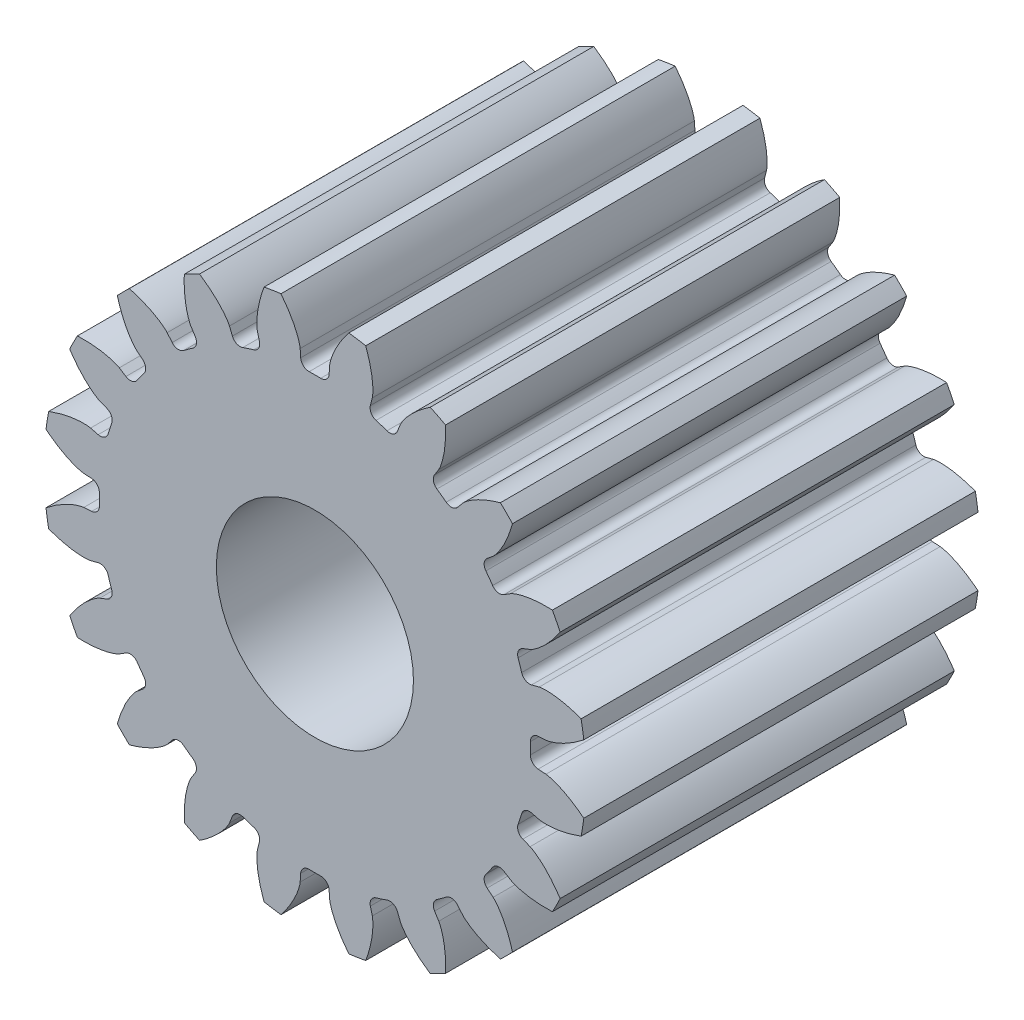
from build123d import *

# Parameters (mm, degrees)
BOSS_EXTRUDE1_DEPTH        = 6.35
BOSS_EXTRUDE1_DEPTH_BACK   = 6.35
SKETCH3_R                  = 8.73125
CUT_EXTRUDE1_DEPTH         = 14.8849542
FILLET1_R                  = 0.266307122
CIRPATTERN1_COUNT          = 20
FILLET1_OF_CIRPATTERN1_R   = 0.266307122
F_1_4_0_2500_DOWEL_HOLE1_D = 6.35


with BuildPart() as part:
    # Sketch3 → Boss-Extrude1 (new, two sides: drawn at the far end of the back side and taken through both)
    with BuildSketch(Plane.XY.offset(-BOSS_EXTRUDE1_DEPTH_BACK)):
        Circle(SKETCH3_R)
    extrude(amount=BOSS_EXTRUDE1_DEPTH + BOSS_EXTRUDE1_DEPTH_BACK)

    # Sketch4 → Cut-Extrude1 (cut, symmetric)
    with BuildSketch(Plane.XY):
        with BuildLine():
            Line((6.931254834, 0.441669736), (7.443713166, 0.474324333))
            add(Edge.make_bspline(
                [(7.443713166, 0.474324333), (7.445749281, 0.474480419), (7.451453983, 0.474999392), (7.462213638, 0.476301083), (7.479726875, 0.478879707), (7.501970922, 0.482832773), (7.530628947, 0.488707219), (7.564257997, 0.496609686), (7.601064508, 0.5063211), (7.640930813, 0.517992074), (7.680534659, 0.530610788), (7.719873659, 0.544103848), (7.758903021, 0.558360044), (7.805981096, 0.576588942), (7.862148006, 0.599780003), (7.927353742, 0.628819757), (8.000758569, 0.664029811), (8.074942785, 0.702332545), (8.147410395, 0.742004754), (8.219980447, 0.784351492), (8.28973336, 0.826927026), (8.361473654, 0.873447803), (8.427334734, 0.917559362), (8.500291543, 0.969502228), (8.558929121, 1.012158882), (8.61877941, 1.058311217), (8.647801029, 1.081081206), (8.662586878, 1.092847266)],
                knots=[0, 0, 0, 0, 0, 0.005376749, 0.015083688, 0.02853182, 0.04661014, 0.064854849, 0.092110526, 0.119476176, 0.146842496, 0.174208854, 0.201574956, 0.228941013, 0.256307345, 0.307035032, 0.361767352, 0.416499661, 0.471231937, 0.525964282, 0.580696616, 0.635428982, 0.690161387, 0.744893688, 0.799626082, 0.854358407, 0.909090915, 0.909090915, 0.909090915, 0.909090915, 0.909090915], degree=4))
            ThreePointArc((8.662586878, 1.092847266), (8.73125, 0), (8.662586878, -1.092847266))
            add(Edge.make_bspline(
                [(7.443713166, -0.474324333), (7.445749281, -0.474480419), (7.451453983, -0.474999392), (7.462213638, -0.476301083), (7.479726875, -0.478879707), (7.501970922, -0.482832773), (7.530628947, -0.488707219), (7.564257997, -0.496609686), (7.601064508, -0.5063211), (7.640930813, -0.517992074), (7.680534659, -0.530610788), (7.719873659, -0.544103848), (7.758903021, -0.558360044), (7.805981096, -0.576588942), (7.862148006, -0.599780003), (7.927353742, -0.628819757), (8.000758569, -0.664029811), (8.074942785, -0.702332545), (8.147410395, -0.742004754), (8.219980447, -0.784351492), (8.28973336, -0.826927026), (8.361473654, -0.873447803), (8.427334734, -0.917559362), (8.500291543, -0.969502228), (8.558929121, -1.012158882), (8.61877941, -1.058311217), (8.647801029, -1.081081206), (8.662586878, -1.092847266)],
                knots=[0, 0, 0, 0, 0, 0.005376749, 0.015083688, 0.02853182, 0.04661014, 0.064854849, 0.092110526, 0.119476176, 0.146842496, 0.174208854, 0.201574956, 0.228941013, 0.256307345, 0.307035032, 0.361767352, 0.416499661, 0.471231937, 0.525964282, 0.580696616, 0.635428982, 0.690161387, 0.744893688, 0.799626082, 0.854358407, 0.909090915, 0.909090915, 0.909090915, 0.909090915, 0.909090915], degree=4))
            Line((7.443713166, -0.474324333), (6.931254834, -0.441669736))
            ThreePointArc((6.931254834, -0.441669736), (6.9453125, 0), (6.931254834, 0.441669736))
        make_face()
    cut_extrude1 = extrude(amount=CUT_EXTRUDE1_DEPTH, both=True, mode=Mode.SUBTRACT)

    # Fillet1
    fillet1_edges = [part.edges().sort_by_distance(p)[0] for p in [
        (6.931254834, -0.441669736, 0),
        (6.931254834, 0.441669736, 0),
    ]]
    fillet(fillet1_edges, radius=FILLET1_R)

    # CirPattern1: Cut-Extrude1 ×20 about axis
    cirpattern1_axis = Axis((0, 0, 6.35), (0, 0, -1))
    for i in range(1, CIRPATTERN1_COUNT):
        add(cut_extrude1.rotate(cirpattern1_axis, i * 360 / CIRPATTERN1_COUNT), mode=Mode.SUBTRACT)

    # Fillet1 of CirPattern1
    fillet1_of_cirpattern1_edges = [part.edges().sort_by_distance(p)[0] for p in [
        (6.455531621, -2.561928416, 0),
        (6.72849853, -1.721822656, 0),
        (5.347895996, -4.431407693, 0),
        (5.86710991, -3.716771049, 0),
        (3.716771049, -5.86710991, 0),
        (4.431407693, -5.347895996, 0),
        (1.721822656, -6.72849853, 0),
        (2.561928416, -6.455531621, 0),
        (-0.441669736, -6.931254834, 0),
        (0.441669736, -6.931254834, 0),
        (-2.561928416, -6.455531621, 0),
        (-1.721822656, -6.72849853, 0),
        (-4.431407693, -5.347895996, 0),
        (-3.716771049, -5.86710991, 0),
        (-5.86710991, -3.716771049, 0),
        (-5.347895996, -4.431407693, 0),
        (-6.72849853, -1.721822656, 0),
        (-6.455531621, -2.561928416, 0),
        (-6.931254834, 0.441669736, 0),
        (-6.931254834, -0.441669736, 0),
        (-6.455531621, 2.561928416, 0),
        (-6.72849853, 1.721822656, 0),
        (-5.347895996, 4.431407693, 0),
        (-5.86710991, 3.716771049, 0),
        (-3.716771049, 5.86710991, 0),
        (-4.431407693, 5.347895996, 0),
        (-1.721822656, 6.72849853, 0),
        (-2.561928416, 6.455531621, 0),
        (0.441669736, 6.931254834, 0),
        (-0.441669736, 6.931254834, 0),
        (2.561928416, 6.455531621, 0),
        (1.721822656, 6.72849853, 0),
        (4.431407693, 5.347895996, 0),
        (3.716771049, 5.86710991, 0),
        (5.86710991, 3.716771049, 0),
        (5.347895996, 4.431407693, 0),
        (6.72849853, 1.721822656, 0),
        (6.455531621, 2.561928416, 0),
    ]]
    fillet(fillet1_of_cirpattern1_edges, radius=FILLET1_OF_CIRPATTERN1_R)

    # 1/4 (0.2500) Dowel Hole1 (through all)
    with Locations(Plane.XY.offset(6.35)):
        with Locations((0, 0)):
            Hole(F_1_4_0_2500_DOWEL_HOLE1_D / 2)


solid = part.part
